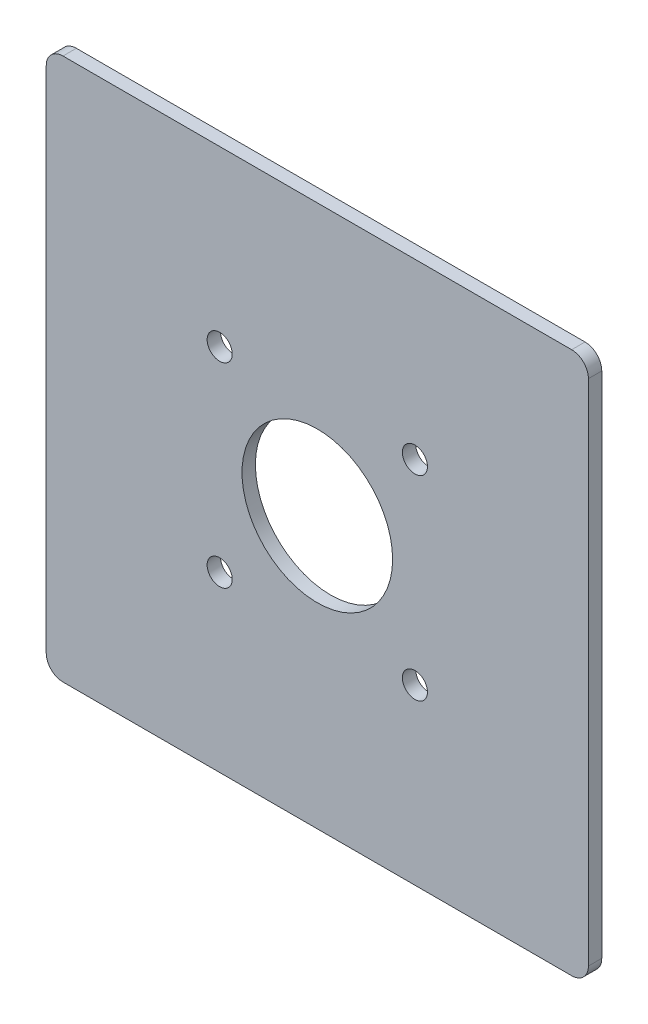
from build123d import *

# Parameters (mm, degrees)
SKETCH1_W           = 324
SKETCH1_H           = 324
BOSS_EXTRUDE1_DEPTH = 8
SKETCH2_R           = 7.5
CUT_EXTRUDE1_DEPTH  = 8
SKETCH3_R           = 45
CUT_EXTRUDE2_DEPTH  = 10
CIRPATTERN1_COUNT   = 4
FILLET1_R           = 10


with BuildPart() as part:
    # Sketch1 → Boss-Extrude1 (new body)
    with BuildSketch(Plane.XY):
        Rectangle(SKETCH1_W, SKETCH1_H)
    extrude(amount=BOSS_EXTRUDE1_DEPTH)

    # Sketch2 → Cut-Extrude1 (cut)
    with BuildSketch(Plane.XY.offset(8)):
        with Locations((58.336309448, 58.336309448)):
            Circle(SKETCH2_R)
    cut_extrude1 = extrude(amount=-CUT_EXTRUDE1_DEPTH, mode=Mode.SUBTRACT)

    # Sketch3 → Cut-Extrude2 (cut)
    with BuildSketch(Plane.XY.offset(8)):
        Circle(SKETCH3_R)
    extrude(amount=-CUT_EXTRUDE2_DEPTH, mode=Mode.SUBTRACT)

    # CirPattern1: Cut-Extrude1 ×4 about axis
    cirpattern1_axis = Axis((0, 0, 0), (0, 0, 1))
    for i in range(1, CIRPATTERN1_COUNT):
        add(cut_extrude1.rotate(cirpattern1_axis, i * 360 / CIRPATTERN1_COUNT), mode=Mode.SUBTRACT)

    # Fillet1
    fillet1_edges = [part.edges().sort_by_distance(p)[0] for p in [
        (162, -162, 4),
        (-162, -162, 4),
        (-162, 162, 4),
        (162, 162, 4),
    ]]
    fillet(fillet1_edges, radius=FILLET1_R)


solid = part.part
